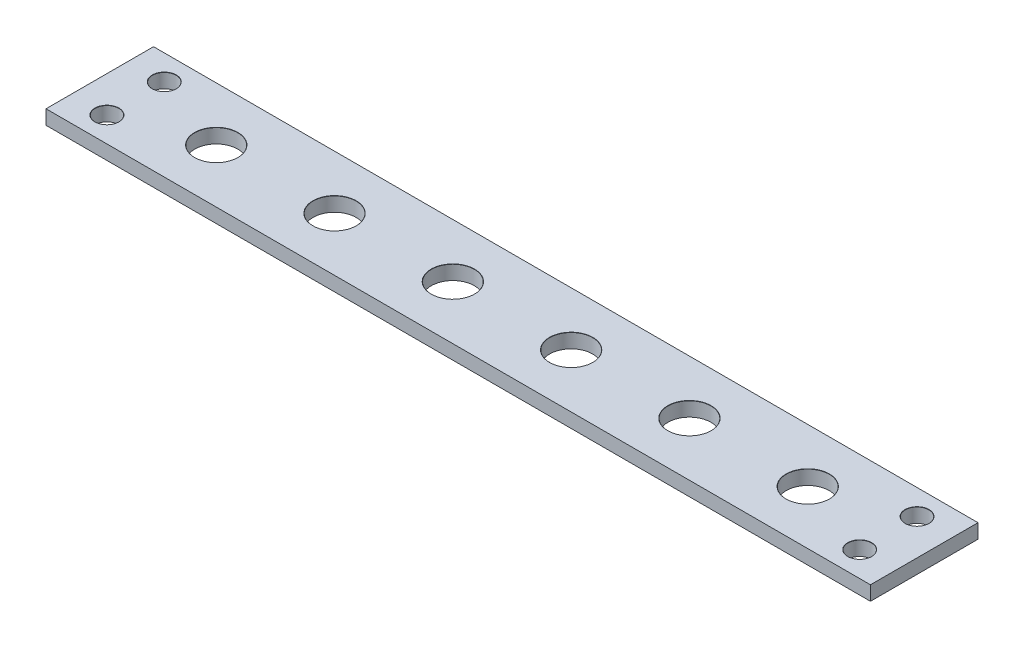
from build123d import *

# Parameters (mm, degrees)
SKETCH1_W                            = 115
SKETCH1_H                            = 15
BOSS_EXTRUDE1_DEPTH                  = 2
F_3_3_3_3_DIAMETER_HOLE1_D           = 3.3
F_3_3_3_3_DIAMETER_HOLE1_DEPTH       = 15
F_3_3_3_3_DIAMETER_HOLE1_CSINK_D     = 3.35
F_3_3_3_3_DIAMETER_HOLE1_CSINK_ANGLE = 90
F_3_3_3_3_DIAMETER_HOLE1_TIP         = 0.991420021
F_6_0_6_DIAMETER_HOLE1_D             = 6
F_6_0_6_DIAMETER_HOLE1_DEPTH         = 15
F_6_0_6_DIAMETER_HOLE1_CSINK_D       = 6.05
F_6_0_6_DIAMETER_HOLE1_CSINK_ANGLE   = 90
F_6_0_6_DIAMETER_HOLE1_TIP           = 1.802581857


with BuildPart() as part:
    # Sketch1 → Boss-Extrude1 (new body)
    with BuildSketch(Plane(origin=(0, 0, 0), x_dir=(1, 0, 0), z_dir=(0, 1, 0))):
        Rectangle(SKETCH1_W, SKETCH1_H)
    extrude(amount=BOSS_EXTRUDE1_DEPTH)

    # Ø3.3 (3.3) Diameter Hole1
    with Locations(Plane(origin=(0, 2, 0), x_dir=(1, 0, 0), z_dir=(0, 1, 0))):
        with Locations((52.5, -4), (-52.5, 4), (-52.5, -4), (52.5, 4)):
            CounterSinkHole(F_3_3_3_3_DIAMETER_HOLE1_D / 2, F_3_3_3_3_DIAMETER_HOLE1_CSINK_D / 2, depth=F_3_3_3_3_DIAMETER_HOLE1_DEPTH, counter_sink_angle=F_3_3_3_3_DIAMETER_HOLE1_CSINK_ANGLE)
            with Locations((0, 0, -(F_3_3_3_3_DIAMETER_HOLE1_DEPTH + F_3_3_3_3_DIAMETER_HOLE1_TIP / 2))):  # 118° drill point
                Cone(0, F_3_3_3_3_DIAMETER_HOLE1_D / 2, F_3_3_3_3_DIAMETER_HOLE1_TIP, mode=Mode.SUBTRACT)

    # Ø6.0 (6) Diameter Hole1
    with Locations(Plane(origin=(0, 2, 0), x_dir=(1, 0, 0), z_dir=(0, 1, 0))):
        with Locations((-8.25, 0), (8.25, 0), (24.75, 0), (41.25, 0), (-24.75, 0), (-41.25, 0)):
            CounterSinkHole(F_6_0_6_DIAMETER_HOLE1_D / 2, F_6_0_6_DIAMETER_HOLE1_CSINK_D / 2, depth=F_6_0_6_DIAMETER_HOLE1_DEPTH, counter_sink_angle=F_6_0_6_DIAMETER_HOLE1_CSINK_ANGLE)
            with Locations((0, 0, -(F_6_0_6_DIAMETER_HOLE1_DEPTH + F_6_0_6_DIAMETER_HOLE1_TIP / 2))):  # 118° drill point
                Cone(0, F_6_0_6_DIAMETER_HOLE1_D / 2, F_6_0_6_DIAMETER_HOLE1_TIP, mode=Mode.SUBTRACT)


solid = part.part
